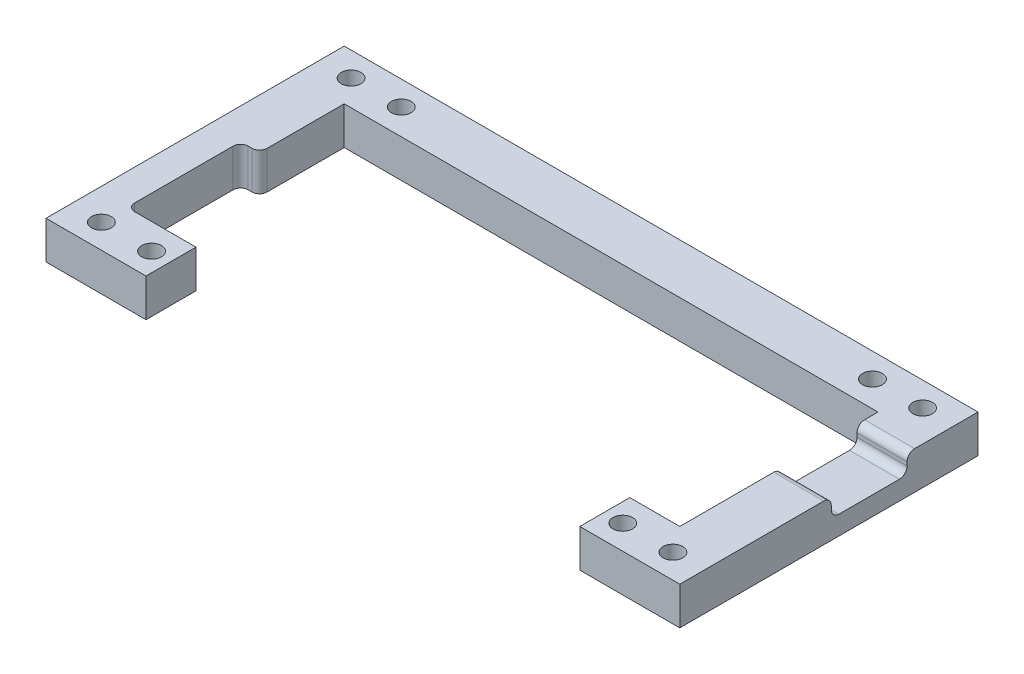
from build123d import *

# Parameters (mm, degrees)
SKETCH1_R           = 1.651
BOSS_EXTRUDE1_DEPTH = 6.35
SKETCH2_W           = 12.7
SKETCH2_H           = 3.175
CUT_EXTRUDE7_DEPTH  = 8.89
FILLET2_R           = 1.27
SKETCH4_W           = 3.175
SKETCH4_H           = 19.05
CUT_EXTRUDE8_DEPTH  = 192.82600491
FILLET3_R           = 1.27
SKETCH5_R           = 2.8575
SKETCH5_R_2         = 3.175
CUT_EXTRUDE9_DEPTH  = 2.54


with BuildPart() as part:
    # Sketch1 → Boss-Extrude1 (new body)
    with BuildSketch(Plane(origin=(0, 0, 0), x_dir=(1, 0, 0), z_dir=(0, 1, 0))):
        Polygon((75.155177047, 61.997896552), (75.155177047, 11.997896552), (91.919177047, 11.997896552), (91.919177047, 20.379896552), (83.537177047, 20.379896552), (83.537177047, 53.615896552), (173.037829354, 53.615896552), (173.037829354, 20.379896552), (164.655829354, 20.379896552), (164.655829354, 11.997896552), (181.419829354, 11.997896552), (181.419829354, 61.997896552), align=None)
        with Locations(Location((80.3721812, 16.064784874, 0), (0, 0, 270))):
            Circle(SKETCH1_R, mode=Mode.SUBTRACT)
        with Locations(Location((80.3721812, 57.93100823, 0), (0, 0, 270))):
            Circle(SKETCH1_R, mode=Mode.SUBTRACT)
        with Locations(Location((88.7874552, 16.064784874, 0), (0, 0, 270))):
            Circle(SKETCH1_R, mode=Mode.SUBTRACT)
        with Locations(Location((167.7875512, 57.93100823, 0), (0, 0, 270))):
            Circle(SKETCH1_R, mode=Mode.SUBTRACT)
        with Locations(Location((88.7874552, 57.93100823, 0), (0, 0, 270))):
            Circle(SKETCH1_R, mode=Mode.SUBTRACT)
        with Locations(Location((176.2028252, 57.93100823, 0), (0, 0, 270))):
            Circle(SKETCH1_R, mode=Mode.SUBTRACT)
        with Locations(Location((176.2028252, 16.064784874, 0), (0, 0, 270))):
            Circle(SKETCH1_R, mode=Mode.SUBTRACT)
        with Locations(Location((167.7875512, 16.064784874, 0), (0, 0, 270))):
            Circle(SKETCH1_R, mode=Mode.SUBTRACT)
    extrude(amount=BOSS_EXTRUDE1_DEPTH)

    # Sketch2 → Cut-Extrude7 (cut)
    with BuildSketch(Plane(origin=(181.419829354, 0, 0), x_dir=(0, 0, -1), z_dir=(1, 0, 0))):
        with Locations((43.747896552, 4.7625)):
            Rectangle(SKETCH2_W, SKETCH2_H)
    extrude(amount=-CUT_EXTRUDE7_DEPTH, mode=Mode.SUBTRACT)

    # Fillet2
    fillet2_edges = [part.edges().sort_by_distance(p)[0] for p in [
        (177.228829354, 6.35, -37.397896552),
        (177.228829354, 6.35, -50.097896552),
        (177.228829354, 3.175, -50.097896552),
        (177.228829354, 3.175, -37.397896552),
    ]]
    fillet(fillet2_edges, radius=FILLET2_R)

    # Sketch4 → Cut-Extrude8 (cut, through all)
    with BuildSketch(Plane(origin=(0, 6.35, 0), x_dir=(1, 0, 0), z_dir=(0, 1, 0))):
        with Locations((81.949677047, 29.904896552)):
            Rectangle(SKETCH4_W, SKETCH4_H)
    extrude(amount=-CUT_EXTRUDE8_DEPTH, mode=Mode.SUBTRACT)

    # Fillet3
    fillet3_edges = [part.edges().sort_by_distance(p)[0] for p in [
        (83.537177047, 3.175, -39.429896552),
        (80.362177047, 3.175, -20.379896552),
        (80.362177047, 3.175, -39.429896552),
    ]]
    fillet(fillet3_edges, radius=FILLET3_R)

    # Sketch5 → Cut-Extrude9 (cut)
    with BuildSketch(Plane.XZ):
        with Locations(Location((88.7874552, -16.064784874, 0), (0, 0, 270))):
            Circle(SKETCH5_R)
        with Locations(Location((88.7874552, -57.93100823, 0), (0, 0, 270))):
            Circle(SKETCH5_R_2)
        with Locations(Location((167.7875512, -57.93100823, 0), (0, 0, 270))):
            Circle(SKETCH5_R_2)
        with Locations(Location((167.7875512, -16.064784874, 0), (0, 0, 270))):
            Circle(SKETCH5_R)
    extrude(amount=-CUT_EXTRUDE9_DEPTH, mode=Mode.SUBTRACT)


solid = part.part
